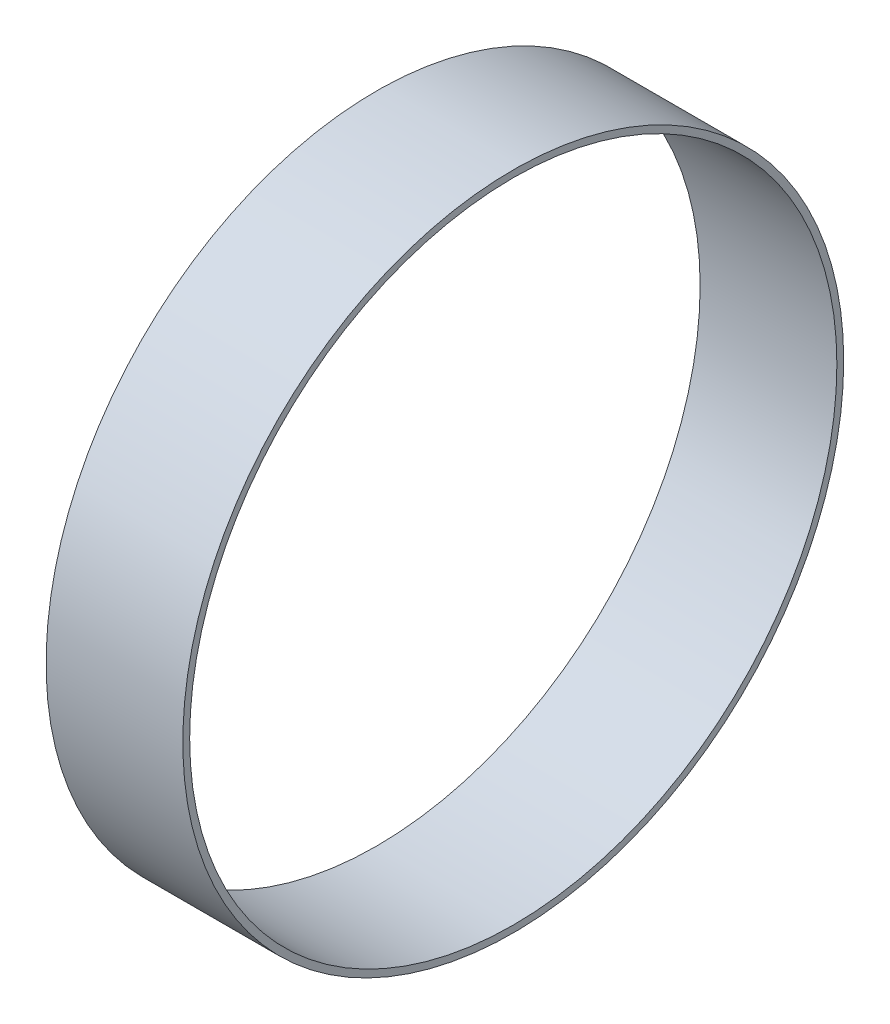
from build123d import *

# Parameters (mm, degrees)
SKETCH1_R           = 72.5
SKETCH1_R_2         = 71
BOSS_EXTRUDE1_DEPTH = 30


with BuildPart() as part:
    # Sketch1 → Boss-Extrude1 (new body)
    with BuildSketch(Plane(origin=(0, 0, 0), x_dir=(0, 0, -1), z_dir=(1, 0, 0))):
        Circle(SKETCH1_R)
        Circle(SKETCH1_R_2, mode=Mode.SUBTRACT)
    extrude(amount=BOSS_EXTRUDE1_DEPTH)


solid = part.part
